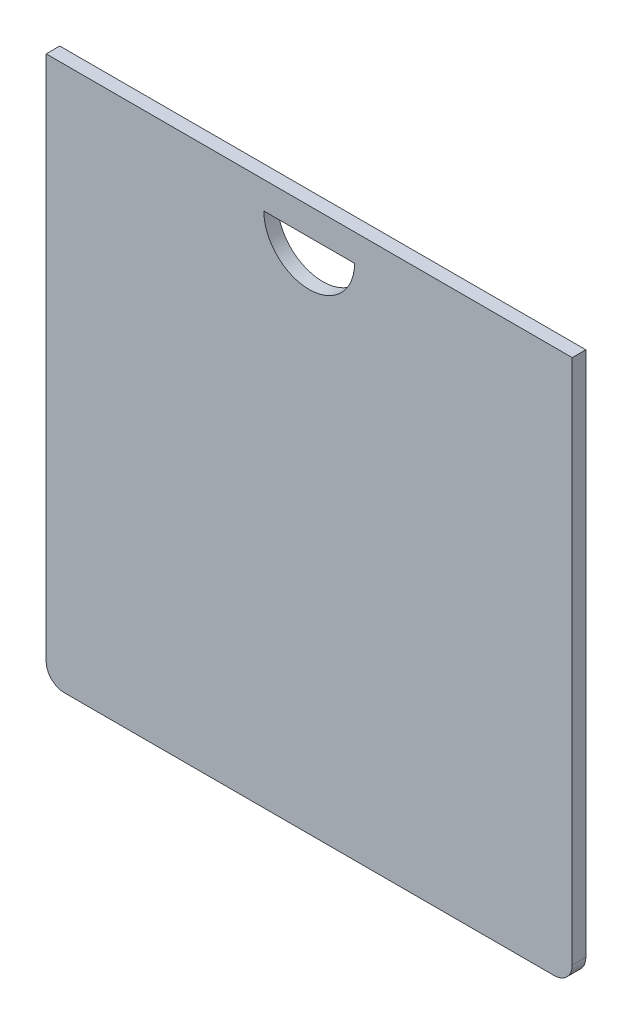
from build123d import *

# Parameters (mm, degrees)
SKETCH_1_W          = 58
SKETCH_1_H          = 60
EXTRUDE_1_DEPTH     = 1.5
FILLET_1_R          = 2
CUT_EXTRUDE_1_DEPTH = 84.464064123


with BuildPart() as part:
    # Эскиз1 → Бобышка-Вытянуть1 (new body)
    with BuildSketch(Plane.XY):
        with Locations((29, 30)):
            Rectangle(SKETCH_1_W, SKETCH_1_H)
    extrude(amount=EXTRUDE_1_DEPTH)

    # Скругление1
    fillet_1_edges = [part.edges().sort_by_distance(p)[0] for p in [
        (58, 0, 0.75),
        (0, 0, 0.75),
    ]]
    fillet(fillet_1_edges, radius=FILLET_1_R)

    # Эскиз2 → Вырез-Вытянуть1 (cut, through all)
    with BuildSketch(Plane.XY.offset(1.5)):
        with BuildLine():
            Line((24, 57), (34, 57))
            ThreePointArc((34, 57), (29, 52), (24, 57))
        make_face()
    extrude(amount=-CUT_EXTRUDE_1_DEPTH, mode=Mode.SUBTRACT)


solid = part.part
